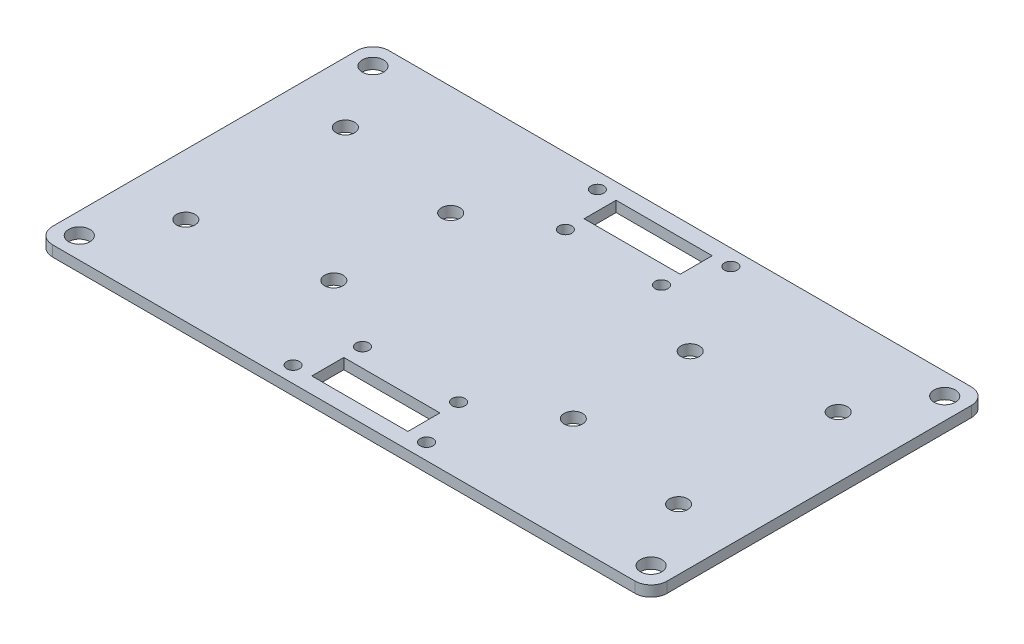
from build123d import *

# Parameters (mm, degrees)
ESBO_O1_W                = 115.09677689
ESBO_O1_H                = 63
RESSALTO_EXTRUS_O1_DEPTH = 2
ESBO_O2_R                = 1.73
CORTE_EXTRUS_O1_DEPTH    = 66.635866816
ESBO_O3_W                = 18
ESBO_O3_H                = 6
CORTE_EXTRUS_O2_DEPTH    = 66.635866816
ESBO_O5_R                = 2
CORTE_EXTRUS_O3_DEPTH    = 66.635866816
FILETE1_R                = 3
ESBO_O8_R                = 1.2
CORTE_EXTRUS_O4_DEPTH    = 66.635866816


with BuildPart() as part:
    # Esboço1 → Ressalto-extrusão1 (new body)
    with BuildSketch(Plane(origin=(0, 0, 0), x_dir=(1, 0, 0), z_dir=(0, 1, 0))):
        Rectangle(ESBO_O1_W, ESBO_O1_H)
    extrude(amount=RESSALTO_EXTRUS_O1_DEPTH)

    # Esboço2 → Corte-extrusão1 (cut, through all)
    with BuildSketch(Plane(origin=(0, 2, 0), x_dir=(1, 0, 0), z_dir=(0, 1, 0))):
        with Locations(Location((-46.153556516, -14.945, 0), (0, 0, 270))):
            Circle(ESBO_O2_R)
        with Locations(Location((-22.428388445, -10.945, 0), (0, 0, 270))):
            Circle(ESBO_O2_R)
        with Locations(Location((22.428388445, -10.945, 0), (0, 0, 90))):
            Circle(ESBO_O2_R)
        with Locations(Location((46.153556516, -14.945, 0), (0, 0, 90))):
            Circle(ESBO_O2_R)
        with Locations(Location((46.153556516, 14.945, 0), (0, 0, 270))):
            Circle(ESBO_O2_R)
        with Locations(Location((22.428388445, 10.945, 0), (0, 0, 270))):
            Circle(ESBO_O2_R)
        with Locations(Location((-22.428388445, 10.945, 0), (0, 0, 90))):
            Circle(ESBO_O2_R)
        with Locations(Location((-46.153556516, 14.945, 0), (0, 0, 90))):
            Circle(ESBO_O2_R)
    extrude(amount=-CORTE_EXTRUS_O1_DEPTH, mode=Mode.SUBTRACT)

    # Esboço3 → Corte-extrusão2 (cut, through all)
    with BuildSketch(Plane.XZ):
        with Locations((0, 25.5)):
            Rectangle(ESBO_O3_W, ESBO_O3_H)
        with Locations((0, -25.5)):
            Rectangle(ESBO_O3_W, ESBO_O3_H)
    extrude(amount=-CORTE_EXTRUS_O2_DEPTH, mode=Mode.SUBTRACT)

    # Esboço5 → Corte-extrusão3 (cut, through all)
    with BuildSketch(Plane(origin=(0, 2, 0), x_dir=(1, 0, 0), z_dir=(0, 1, 0))):
        with Locations(Location((53.548388445, 27.5, 0), (0, 0, 270))):
            Circle(ESBO_O5_R)
        with Locations(Location((53.548388445, -27.5, 0), (0, 0, 90))):
            Circle(ESBO_O5_R)
        with Locations(Location((-53.548388445, -27.5, 0), (0, 0, 270))):
            Circle(ESBO_O5_R)
        with Locations(Location((-53.548388445, 27.5, 0), (0, 0, 90))):
            Circle(ESBO_O5_R)
    extrude(amount=-CORTE_EXTRUS_O3_DEPTH, mode=Mode.SUBTRACT)

    # Filete1
    filete1_edges = [part.edges().sort_by_distance(p)[0] for p in [
        (-57.548388445, 1, -31.5),
        (57.548388445, 1, -31.5),
        (57.548388445, 1, 31.5),
        (-57.548388445, 1, 31.5),
    ]]
    fillet(filete1_edges, radius=FILETE1_R)

    # Esboço8 → Corte-extrusão4 (cut, through all)
    with BuildSketch(Plane(origin=(0, 2, 0), x_dir=(1, 0, 0), z_dir=(0, 1, 0))):
        with Locations(Location((-12.498388445, 28.5, 0), (0, 0, 270))):
            Circle(ESBO_O8_R)
        with Locations(Location((12.498388445, 28.5, 0), (0, 0, 90))):
            Circle(ESBO_O8_R)
        with Locations(Location((12.498388445, -28.5, 0), (0, 0, 270))):
            Circle(ESBO_O8_R)
        with Locations(Location((-12.498388445, -28.5, 0), (0, 0, 90))):
            Circle(ESBO_O8_R)
        with Locations(Location((-8.998388445, -19, 0), (0, 0, 270))):
            Circle(ESBO_O8_R)
        with Locations(Location((8.998388445, -19, 0), (0, 0, 90))):
            Circle(ESBO_O8_R)
        with Locations(Location((8.998388445, 19, 0), (0, 0, 270))):
            Circle(ESBO_O8_R)
        with Locations(Location((-8.998388445, 19, 0), (0, 0, 90))):
            Circle(ESBO_O8_R)
    extrude(amount=-CORTE_EXTRUS_O4_DEPTH, mode=Mode.SUBTRACT)


solid = part.part
